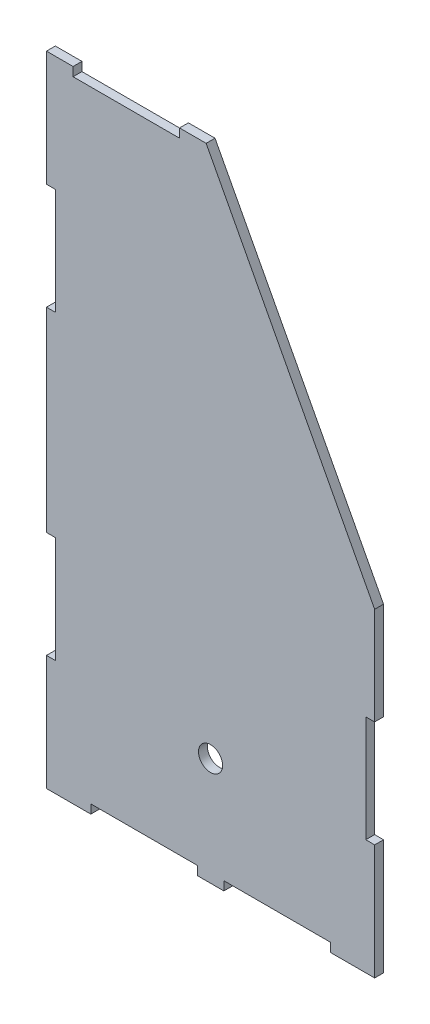
from build123d import *

# Parameters (mm, degrees)
BOSS_EXTRUDE3_DEPTH     = 6.35
SKETCH2_W               = 76.2
SKETCH2_H               = 6.35
SKETCH2_W_2             = 6.35
SKETCH2_H_2             = 76.2
CUT_EXTRUDE1_DEPTH      = 851.086415125
CUT_EXTRUDE3_DEPTH      = 851.086415125
CUT_EXTRUDE3_DEPTH_BACK = 851.086415125
SKETCH3_R               = 8.636


with BuildPart() as part:
    # Sketch1 → Boss-Extrude3 (new body)
    with BuildSketch(Plane.XY):
        Polygon((435.519883673, 642.86985555), (556.169883673, 414.26985555), (556.169883673, 185.66985555), (321.219883673, 185.66985555), (321.219883673, 642.86985555), align=None)
    extrude(amount=BOSS_EXTRUDE3_DEPTH)

    # Sketch2 → Cut-Extrude1 (cut, through all)
    with BuildSketch(Plane.XY.offset(6.35)):
        with Locations((378.369883673, 639.69485555)):
            Rectangle(SKETCH2_W, SKETCH2_H)
        with Locations((324.394883673, 522.21985555)):
            Rectangle(SKETCH2_W_2, SKETCH2_H_2)
        with Locations((324.394883673, 306.31985555)):
            Rectangle(SKETCH2_W_2, SKETCH2_H_2)
        with Locations((391.069883673, 188.84485555)):
            Rectangle(SKETCH2_W, SKETCH2_H)
        with Locations((486.319883673, 188.84485555)):
            Rectangle(SKETCH2_W, SKETCH2_H)
        with Locations((552.994883673, 306.31985555)):
            Rectangle(SKETCH2_W_2, SKETCH2_H_2)
    extrude(amount=-CUT_EXTRUDE1_DEPTH, mode=Mode.SUBTRACT)

    # Sketch3 → Cut-Extrude3 (cut, two sides: drawn at the far end of the back side and taken through both)
    with BuildSketch(Plane.XY.offset(-CUT_EXTRUDE3_DEPTH_BACK)):
        with Locations((438.694883673, 262.989065336)):
            Circle(SKETCH3_R)
    extrude(amount=CUT_EXTRUDE3_DEPTH + CUT_EXTRUDE3_DEPTH_BACK, mode=Mode.SUBTRACT)


solid = part.part
